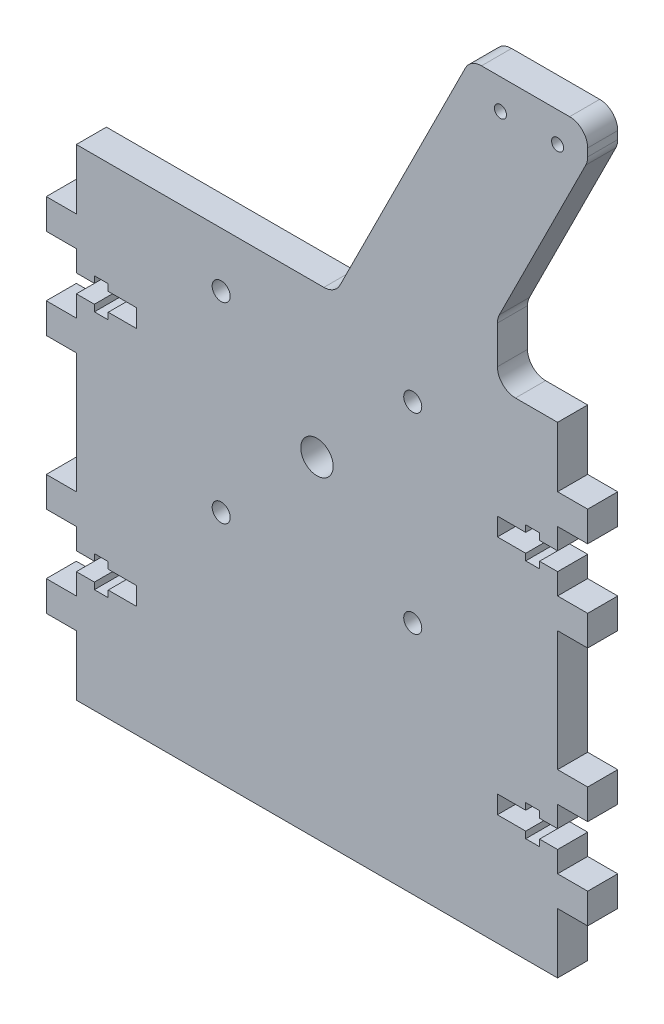
from build123d import *

# Parameters (mm, degrees)
SKETCH1_R           = 1.5
SKETCH1_R_2         = 11.5
BOSS_EXTRUDE1_DEPTH = 5
BOSS_EXTRUDE2_START = -5
SKETCH2_R           = 11.5
SKETCH2_R_2         = 2.7
BOSS_EXTRUDE2_DEPTH = 5
SKETCH3_R           = 1
BOSS_EXTRUDE3_DEPTH = 5
FILLET1_R           = 3


with BuildPart() as part:
    # Sketch1 → Boss-Extrude1 (new body)
    with BuildSketch(Plane.XY):
        Polygon((0, 80), (-80, 80), (-80, 70), (-85, 70), (-85, 65), (-80, 65), (-80, 61.5), (-77, 61.5), (-77, 62.6), (-74.7, 62.6), (-74.7, 61.5), (-70, 61.5), (-70, 58.5), (-74.7, 58.5), (-74.7, 57.4), (-77, 57.4), (-77, 58.5), (-80, 58.5), (-80, 55), (-85, 55), (-85, 50), (-80, 50), (-80, 30), (-85, 30), (-85, 25), (-80, 25), (-80, 21.5), (-77, 21.5), (-77, 22.6), (-74.7, 22.6), (-74.7, 21.5), (-70, 21.5), (-70, 18.5), (-74.7, 18.5), (-74.7, 17.4), (-77, 17.4), (-77, 18.5), (-80, 18.5), (-80, 15), (-85, 15), (-85, 10), (-80, 10), (-80, 0), (0, 0), (0, 10), (5, 10), (5, 15), (0, 15), (0, 18.5), (-3, 18.5), (-3, 17.4), (-5.3, 17.4), (-5.3, 18.5), (-10, 18.5), (-10, 21.5), (-5.3, 21.5), (-5.3, 22.6), (-3, 22.6), (-3, 21.5), (0, 21.5), (0, 25), (5, 25), (5, 30), (0, 30), (0, 50), (5, 50), (5, 55), (0, 55), (0, 58.5), (-3, 58.5), (-3, 57.4), (-5.3, 57.4), (-5.3, 58.5), (-10, 58.5), (-10, 61.5), (-5.3, 61.5), (-5.3, 62.6), (-3, 62.6), (-3, 61.5), (0, 61.5), (0, 65), (5, 65), (5, 70), (0, 70), align=None)
        with Locations((-55.922, 70.922)):
            Circle(SKETCH1_R, mode=Mode.SUBTRACT)
        with Locations((-24.078, 70.922)):
            Circle(SKETCH1_R, mode=Mode.SUBTRACT)
        with Locations((-24.078, 39.078)):
            Circle(SKETCH1_R, mode=Mode.SUBTRACT)
        with Locations((-55.922, 39.078)):
            Circle(SKETCH1_R, mode=Mode.SUBTRACT)
        with Locations((-40, 55)):
            Circle(SKETCH1_R_2, mode=Mode.SUBTRACT)
    extrude(amount=BOSS_EXTRUDE1_DEPTH)

    # Sketch2 → Boss-Extrude2 (add)
    with BuildSketch(Plane.XY.offset(5).offset(BOSS_EXTRUDE2_START)):
        with Locations((-40, 55)):
            Circle(SKETCH2_R)
        with Locations((-40, 55)):
            Circle(SKETCH2_R_2, mode=Mode.SUBTRACT)
    extrude(amount=BOSS_EXTRUDE2_DEPTH)

    # Sketch3 → Boss-Extrude3 (add)
    with BuildSketch(Plane.XY.offset(5)):
        Polygon((5, 125), (-14.5, 125), (-37, 80), (-10, 80), (-10, 90), (5, 120), align=None)
        with Locations((-9.5, 120)):
            Circle(SKETCH3_R, mode=Mode.SUBTRACT)
        with Locations((0, 120)):
            Circle(SKETCH3_R, mode=Mode.SUBTRACT)
    extrude(amount=-BOSS_EXTRUDE3_DEPTH)

    # Fillet1
    fillet1_edges = [part.edges().sort_by_distance(p)[0] for p in [
        (-10, 90, 2.5),
        (-10, 80, 2.5),
        (-37, 80, 2.5),
        (-14.5, 125, 2.5),
        (5, 125, 2.5),
        (5, 120, 2.5),
    ]]
    fillet(fillet1_edges, radius=FILLET1_R)


solid = part.part
